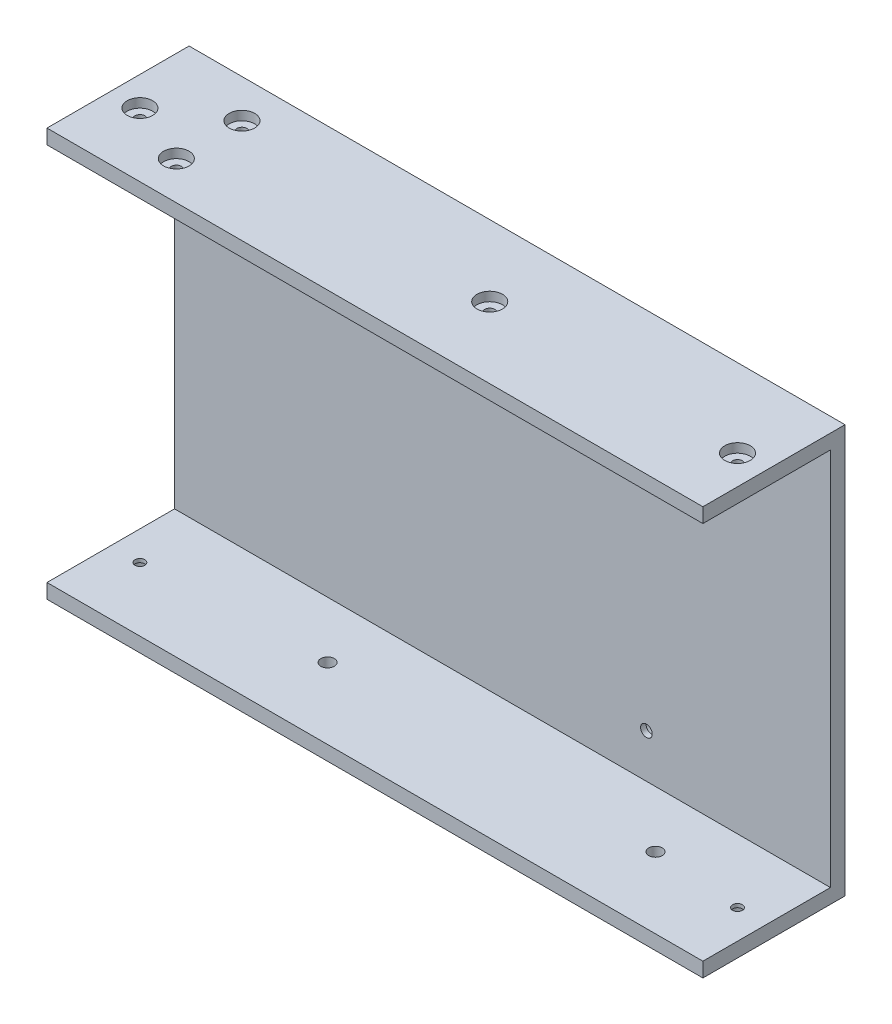
from build123d import *

# Parameters (mm, degrees)
SKICA1_W                 = 180
SKICA1_H                 = 112
P_IDAT_VYSUNUT_M1_DEPTH  = 4
SKICA3_W                 = 180
SKICA3_H                 = 4
P_IDAT_VYSUNUT_M2_DEPTH  = 35
SKICA4_R                 = 1.35
ODEBRAT_VYSUNUT_M1_DEPTH = 4
ODEBRAT_VYSUNUT_M2_REACH = 164.096
SKICA6_R                 = 1.35
SKICA7_R                 = 3.5
ODEBRAT_VYSUNUT_M3_DEPTH = 3
SKICA8_R                 = 1.85
ODEBRAT_VYSUNUT_M4_DEPTH = 4
ODEBRAT_START            = -2.5
SKICA9_R                 = 3.5
ODEBRAT_VYSUNUT_M5_DEPTH = 2.5
SKICA10_R                = 1.6
ODEBRAT_VYSUNUT_M6_DEPTH = 4
SKICA11_R                = 3.5
ODEBRAT_VYSUNUT_M7_DEPTH = 2.5


with BuildPart() as part:
    # Skica1 → Přidat vysunutím1 (new body)
    with BuildSketch(Plane.XY):
        with Locations((20.5, -3.5)):
            Rectangle(SKICA1_W, SKICA1_H)
    extrude(amount=P_IDAT_VYSUNUT_M1_DEPTH)

    # Skica3 → Přidat vysunutím2 (add)
    with BuildSketch(Plane.XY.offset(4)):
        with Locations((20.5, 50.5)):
            Rectangle(SKICA3_W, SKICA3_H)
        with Locations((20.5, -57.5)):
            Rectangle(SKICA3_W, SKICA3_H)
    extrude(amount=P_IDAT_VYSUNUT_M2_DEPTH)

    # Skica4 → Odebrat vysunutím1 (cut)
    with BuildSketch(Plane(origin=(0, 52.5, 0), x_dir=(1, 0, 0), z_dir=(0, 1, 0))):
        with Locations(Location((32.5, -19.5, 0), (0, 0, 270))):
            Circle(SKICA4_R)
        with Locations(Location((-44.5, -10.5, 0), (0, 0, 270))):
            Circle(SKICA4_R)
        with Locations(Location((-44.5, -28.5, 0), (0, 0, 270))):
            Circle(SKICA4_R)
    extrude(amount=-ODEBRAT_VYSUNUT_M1_DEPTH, mode=Mode.SUBTRACT)

    # Odebrat vysunutím2: up to this face of the body (flat: up to its plane)
    odebrat_vysunut_m2_end = Plane(part.part.faces().sort_by_distance((20.596477546, 52.5, 19.5))[0])
    # Skica6 → Odebrat vysunutím2 (cut, up to the picked face)
    with BuildSketch(Plane.XZ.offset(59.5), mode=Mode.PRIVATE) as odebrat_vysunut_m2_sk1:
        with Locations(Location((102.5, 21.5, 0), (0, 0, 270))):
            Circle(SKICA6_R)
    odebrat_vysunut_m2_tool1 = split(extrude(odebrat_vysunut_m2_sk1.sketch, amount=-ODEBRAT_VYSUNUT_M2_REACH, mode=Mode.PRIVATE), bisect_by=odebrat_vysunut_m2_end, keep=Keep.BOTH, mode=Mode.PRIVATE)
    # Skica6 → Odebrat vysunutím2 (cut, up to the picked face)
    with BuildSketch(Plane.XZ.offset(59.5), mode=Mode.PRIVATE) as odebrat_vysunut_m2_sk2:
        with Locations(Location((-61.5, 21.5, 0), (0, 0, 270))):
            Circle(SKICA6_R)
    odebrat_vysunut_m2_tool2 = split(extrude(odebrat_vysunut_m2_sk2.sketch, amount=-ODEBRAT_VYSUNUT_M2_REACH, mode=Mode.PRIVATE), bisect_by=odebrat_vysunut_m2_end, keep=Keep.BOTH, mode=Mode.PRIVATE)
    add(odebrat_vysunut_m2_tool1.solids().sort_by(Axis((102.5, -59.5, 21.5), (0, 1, 0)))[0], mode=Mode.SUBTRACT)
    add(odebrat_vysunut_m2_tool2.solids().sort_by(Axis((-61.5, -59.5, 21.5), (0, 1, 0)))[0], mode=Mode.SUBTRACT)

    # Skica7 → Odebrat vysunutím3 (cut)
    with BuildSketch(Plane.XZ.offset(59.5)):
        with Locations(Location((-61.5, 21.5, 0), (0, 0, 270))):
            Circle(SKICA7_R)
        with Locations(Location((102.5, 21.5, 0), (0, 0, 270))):
            Circle(SKICA7_R)
    extrude(amount=-ODEBRAT_VYSUNUT_M3_DEPTH, mode=Mode.SUBTRACT)

    # Skica8 → Odebrat vysunutím4 (cut)
    with BuildSketch(Plane.XZ.offset(59.5)):
        with Locations(Location((-12, 19.5, 0), (0, 0, 270))):
            Circle(SKICA8_R)
        with Locations(Location((78, 19.5, 0), (0, 0, 270))):
            Circle(SKICA8_R)
    extrude(amount=-ODEBRAT_VYSUNUT_M4_DEPTH, mode=Mode.SUBTRACT)

    # Skica9 → Odebrat vysunutím5 (cut)
    with BuildSketch(Plane(origin=(0, 52.5, 0), x_dir=(1, 0, 0), z_dir=(0, 1, 0)).offset(ODEBRAT_START)):
        with Locations(Location((-61.5, -21.5, 0), (0, 0, 90))):
            Circle(SKICA9_R)
        with Locations(Location((-44.5, -10.5, 0), (0, 0, 270))):
            Circle(SKICA9_R)
        with Locations(Location((-44.5, -28.5, 0), (0, 0, 270))):
            Circle(SKICA9_R)
        with Locations(Location((32.5, -19.5, 0), (0, 0, 270))):
            Circle(SKICA9_R)
        with Locations(Location((102.5, -21.5, 0), (0, 0, 90))):
            Circle(SKICA9_R)
    extrude(amount=ODEBRAT_VYSUNUT_M5_DEPTH, mode=Mode.SUBTRACT)

    # Skica10 → Odebrat vysunutím6 (cut)
    with BuildSketch(Plane(origin=(0, 0, 0), x_dir=(-1, 0, 0), z_dir=(0, 0, -1))):
        with Locations((-60, -43.5)):
            Circle(SKICA10_R)
    extrude(amount=-ODEBRAT_VYSUNUT_M6_DEPTH, mode=Mode.SUBTRACT)

    # Skica11 → Odebrat vysunutím7 (cut)
    with BuildSketch(Plane(origin=(0, 0, 0), x_dir=(-1, 0, 0), z_dir=(0, 0, -1))):
        with Locations((-60, -43.5)):
            Circle(SKICA11_R)
    extrude(amount=-ODEBRAT_VYSUNUT_M7_DEPTH, mode=Mode.SUBTRACT)


solid = part.part
